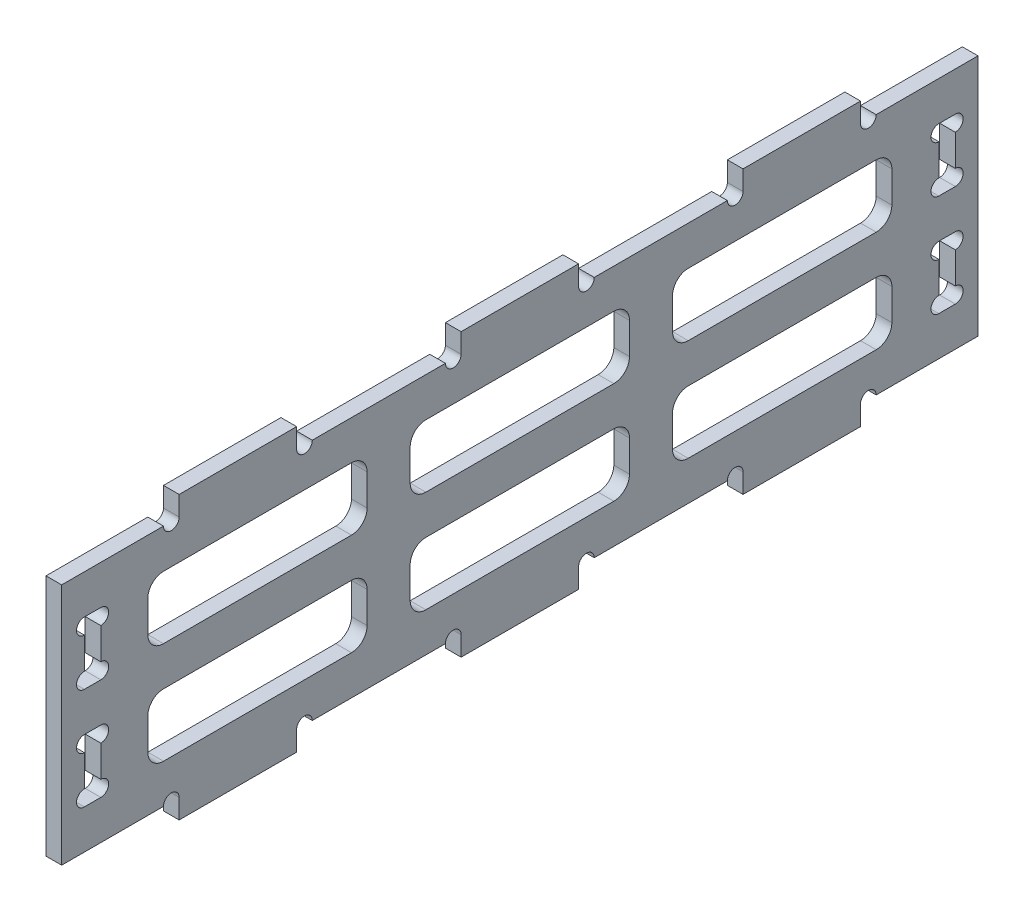
from build123d import *

# Parameters (mm, degrees)
SKETCH_1_W          = 107
SKETCH_1_H          = 31
EXTRUDE_1_DEPTH     = 2
EXTRUDE_2_DEPTH     = 2
CUT_EXTRUDE_1_DEPTH = 117.228223767
SKETCH_5_W          = 15
SKETCH_5_H          = 2.5
EXTRUDE_3_DEPTH     = 2
CUT_EXTRUDE_2_DEPTH = 117.919844338
CUT_EXTRUDE_3_DEPTH = 117.919844338


with BuildPart() as part:
    # 草图1 → 凸台-拉伸1 (new body)
    with BuildSketch(Plane(origin=(0, 0, 0), x_dir=(0, 0, -1), z_dir=(1, 0, 0))):
        with Locations((53.5, 15.5)):
            Rectangle(SKETCH_1_W, SKETCH_1_H)
    extrude(amount=EXTRUDE_1_DEPTH)

    # 草图2 → 凸台-拉伸2 (add)
    with BuildSketch(Plane(origin=(2, 0, 0), x_dir=(0, 0, -1), z_dir=(1, 0, 0))):
        Polygon((0, 31), (-5, 31), (-5, 0), (0, 0), (0, 5), (-2.1, 5), (-2.1, 13), (0, 13), (0, 18), (-2.1, 18), (-2.1, 26), (0, 26), align=None)
        Polygon((107, 0), (107, 5), (109.1, 5), (109.1, 13), (107, 13), (107, 18), (109.1, 18), (109.1, 26), (107, 26), (107, 31), (112, 31), (112, 0), align=None)
    extrude(amount=-EXTRUDE_2_DEPTH)

    # 草图3 → 切除-拉伸1 (cut, through all)
    with BuildSketch(Plane(origin=(2, 0, 0), x_dir=(0, 0, -1), z_dir=(1, 0, 0))):
        with BuildLine():
            Line((-2.1, 24), (-2.1, 26))
            ThreePointArc((-2.1, 26), (-3.1, 25), (-2.1, 24))
        make_face()
        with BuildLine():
            Line((0, 24), (0, 26))
            ThreePointArc((0, 26), (1, 25), (0, 24))
        make_face()
        with BuildLine():
            Line((0, 20), (0, 18))
            ThreePointArc((0, 18), (1, 19), (0, 20))
        make_face()
        with BuildLine():
            Line((-2.1, 20), (-2.1, 18))
            ThreePointArc((-2.1, 18), (-3.1, 19), (-2.1, 20))
        make_face()
        with BuildLine():
            Line((-2.1, 11), (-2.1, 13))
            ThreePointArc((-2.1, 13), (-3.1, 12), (-2.1, 11))
        make_face()
        with BuildLine():
            Line((0, 11), (0, 13))
            ThreePointArc((0, 13), (1, 12), (0, 11))
        make_face()
        with BuildLine():
            Line((0, 7), (0, 5))
            ThreePointArc((0, 5), (1, 6), (0, 7))
        make_face()
        with BuildLine():
            Line((-2.1, 7), (-2.1, 5))
            ThreePointArc((-2.1, 5), (-3.1, 6), (-2.1, 7))
        make_face()
        with BuildLine():
            Line((109.1, 7), (109.1, 5))
            ThreePointArc((109.1, 5), (110.1, 6), (109.1, 7))
        make_face()
        with BuildLine():
            Line((107, 7), (107, 5))
            ThreePointArc((107, 5), (106, 6), (107, 7))
        make_face()
        with BuildLine():
            Line((107, 11), (107, 13))
            ThreePointArc((107, 13), (106, 12), (107, 11))
        make_face()
        with BuildLine():
            Line((109.1, 11), (109.1, 13))
            ThreePointArc((109.1, 13), (110.1, 12), (109.1, 11))
        make_face()
        with BuildLine():
            Line((109.1, 20), (109.1, 18))
            ThreePointArc((109.1, 18), (110.1, 19), (109.1, 20))
        make_face()
        with BuildLine():
            Line((107, 20), (107, 18))
            ThreePointArc((107, 18), (106, 19), (107, 20))
        make_face()
        with BuildLine():
            Line((107, 24), (107, 26))
            ThreePointArc((107, 26), (106, 25), (107, 24))
        make_face()
        with BuildLine():
            Line((109.1, 24), (109.1, 26))
            ThreePointArc((109.1, 26), (110.1, 25), (109.1, 24))
        make_face()
    extrude(amount=-CUT_EXTRUDE_1_DEPTH, mode=Mode.SUBTRACT)

    # 草图5 → 凸台-拉伸3 (add)
    with BuildSketch(Plane(origin=(2, 0, 0), x_dir=(0, 0, -1), z_dir=(1, 0, 0))):
        with Locations((17.5, 32.25)):
            Rectangle(SKETCH_5_W, SKETCH_5_H)
        with Locations((53.5, 32.25)):
            Rectangle(SKETCH_5_W, SKETCH_5_H)
        with Locations((89.5, 32.25)):
            Rectangle(SKETCH_5_W, SKETCH_5_H)
        with Locations((89.5, -1.25)):
            Rectangle(SKETCH_5_W, SKETCH_5_H)
        with Locations((53.5, -1.25)):
            Rectangle(SKETCH_5_W, SKETCH_5_H)
        with Locations((17.5, -1.25)):
            Rectangle(SKETCH_5_W, SKETCH_5_H)
    extrude(amount=-EXTRUDE_3_DEPTH)

    # 草图6 → 切除-拉伸2 (cut, through all)
    with BuildSketch(Plane(origin=(2, 0, 0), x_dir=(0, 0, -1), z_dir=(1, 0, 0))):
        with BuildLine():
            Line((10, 31), (8, 31))
            ThreePointArc((8, 31), (9, 30), (10, 31))
        make_face()
        with BuildLine():
            Line((25, 31), (27, 31))
            ThreePointArc((27, 31), (26, 30), (25, 31))
        make_face()
        with BuildLine():
            Line((46, 31), (44, 31))
            ThreePointArc((44, 31), (45, 30), (46, 31))
        make_face()
        with BuildLine():
            Line((61, 31), (63, 31))
            ThreePointArc((63, 31), (62, 30), (61, 31))
        make_face()
        with BuildLine():
            Line((82, 31), (80, 31))
            ThreePointArc((80, 31), (81, 30), (82, 31))
        make_face()
        with BuildLine():
            Line((97, 31), (99, 31))
            ThreePointArc((99, 31), (98, 30), (97, 31))
        make_face()
        with BuildLine():
            Line((97, 0), (99, 0))
            ThreePointArc((99, 0), (98, 1), (97, 0))
        make_face()
        with BuildLine():
            Line((82, 0), (80, 0))
            ThreePointArc((80, 0), (81, 1), (82, 0))
        make_face()
        with BuildLine():
            Line((61, 0), (63, 0))
            ThreePointArc((63, 0), (62, 1), (61, 0))
        make_face()
        with BuildLine():
            Line((46, 0), (44, 0))
            ThreePointArc((44, 0), (45, 1), (46, 0))
        make_face()
        with BuildLine():
            Line((25, 0), (27, 0))
            ThreePointArc((27, 0), (26, 1), (25, 0))
        make_face()
        with BuildLine():
            Line((10, 0), (8, 0))
            ThreePointArc((8, 0), (9, 1), (10, 0))
        make_face()
    extrude(amount=-CUT_EXTRUDE_2_DEPTH, mode=Mode.SUBTRACT)

    # 草图7 → 切除-拉伸3 (cut, through all)
    with BuildSketch(Plane(origin=(2, 0, 0), x_dir=(0, 0, -1), z_dir=(1, 0, 0))):
        with BuildLine():
            Line((8, 26), (32, 26))
            ThreePointArc((32, 26), (33.414213562, 25.414213562), (34, 24))
            Line((34, 24), (34, 20))
            ThreePointArc((34, 20), (33.414213562, 18.585786438), (32, 18))
            Line((32, 18), (8, 18))
            ThreePointArc((8, 18), (6.585786438, 18.585786438), (6, 20))
            Line((6, 20), (6, 24))
            ThreePointArc((6, 24), (6.585786438, 25.414213562), (8, 26))
        make_face()
        with BuildLine():
            Line((39.5, 24), (39.5, 20))
            ThreePointArc((39.5, 20), (40.085786438, 18.585786438), (41.5, 18))
            Line((41.5, 18), (65.5, 18))
            ThreePointArc((65.5, 18), (66.914213562, 18.585786438), (67.5, 20))
            Line((67.5, 20), (67.5, 24))
            ThreePointArc((67.5, 24), (66.914213562, 25.414213562), (65.5, 26))
            Line((65.5, 26), (41.5, 26))
            ThreePointArc((41.5, 26), (40.085786438, 25.414213562), (39.5, 24))
        make_face()
        with BuildLine():
            Line((73, 24), (73, 20))
            ThreePointArc((73, 20), (73.585786438, 18.585786438), (75, 18))
            Line((75, 18), (99, 18))
            ThreePointArc((99, 18), (100.414213562, 18.585786438), (101, 20))
            Line((101, 20), (101, 24))
            ThreePointArc((101, 24), (100.414213562, 25.414213562), (99, 26))
            Line((99, 26), (75, 26))
            ThreePointArc((75, 26), (73.585786438, 25.414213562), (73, 24))
        make_face()
        with BuildLine():
            Line((39.5, 11), (39.5, 7))
            ThreePointArc((39.5, 7), (40.085786438, 5.585786438), (41.5, 5))
            Line((41.5, 5), (65.5, 5))
            ThreePointArc((65.5, 5), (66.914213562, 5.585786438), (67.5, 7))
            Line((67.5, 7), (67.5, 11))
            ThreePointArc((67.5, 11), (66.914213562, 12.414213562), (65.5, 13))
            Line((65.5, 13), (41.5, 13))
            ThreePointArc((41.5, 13), (40.085786438, 12.414213562), (39.5, 11))
        make_face()
        with BuildLine():
            Line((73, 11), (73, 7))
            ThreePointArc((73, 7), (73.585786438, 5.585786438), (75, 5))
            Line((75, 5), (99, 5))
            ThreePointArc((99, 5), (100.414213562, 5.585786438), (101, 7))
            Line((101, 7), (101, 11))
            ThreePointArc((101, 11), (100.414213562, 12.414213562), (99, 13))
            Line((99, 13), (75, 13))
            ThreePointArc((75, 13), (73.585786438, 12.414213562), (73, 11))
        make_face()
        with BuildLine():
            Line((6, 11), (6, 7))
            ThreePointArc((6, 7), (6.585786438, 5.585786438), (8, 5))
            Line((8, 5), (32, 5))
            ThreePointArc((32, 5), (33.414213562, 5.585786438), (34, 7))
            Line((34, 7), (34, 11))
            ThreePointArc((34, 11), (33.414213562, 12.414213562), (32, 13))
            Line((32, 13), (8, 13))
            ThreePointArc((8, 13), (6.585786438, 12.414213562), (6, 11))
        make_face()
    extrude(amount=-CUT_EXTRUDE_3_DEPTH, mode=Mode.SUBTRACT)


solid = part.part
